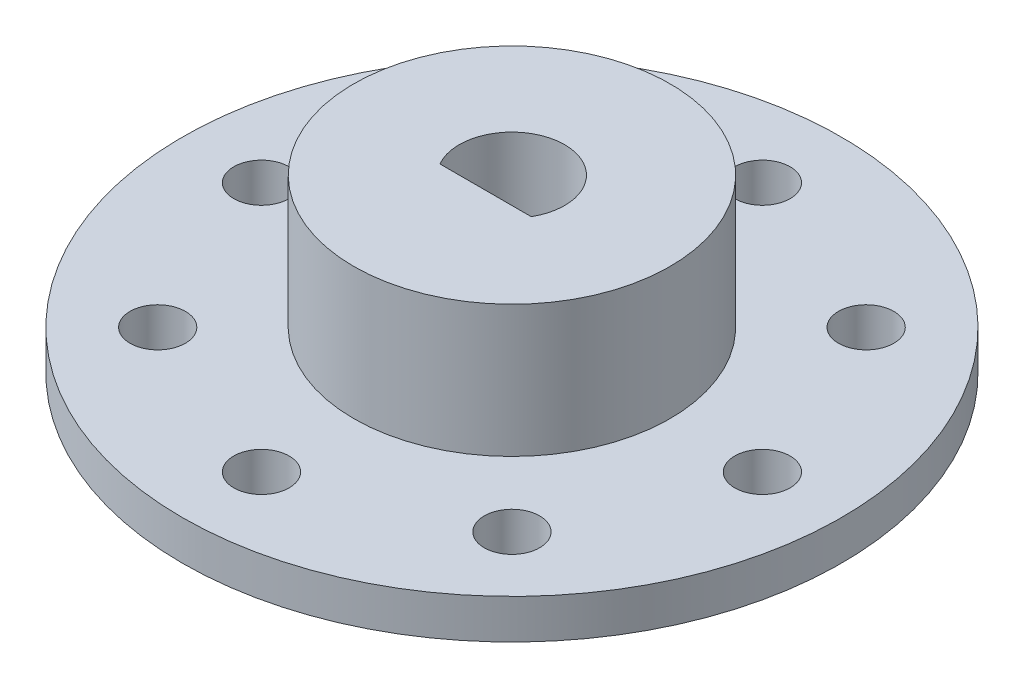
from build123d import *

# Parameters (mm, degrees)
SKETCH_1_R          = 25
SKETCH_1_R_2        = 2.1
EXTRUDE_1_DEPTH     = 3
SKETCH_2_R          = 12
EXTRUDE_2_DEPTH     = 10
CUT_EXTRUDE_START   = -20
CUT_EXTRUDE_1_DEPTH = 20


with BuildPart() as part:
    # 草图1 → 凸台-拉伸1 (new body)
    with BuildSketch(Plane(origin=(0, 0, 0), x_dir=(1, 0, 0), z_dir=(0, 1, 0))):
        with Locations(Location((0, 0, 0), (0, 0, 270))):
            Circle(SKETCH_1_R)
        with Locations(Location((0, 19, 0), (0, 0, 270))):
            Circle(SKETCH_1_R_2, mode=Mode.SUBTRACT)
        with Locations(Location((13.435028843, 13.435028843, 0), (0, 0, 270))):
            Circle(SKETCH_1_R_2, mode=Mode.SUBTRACT)
        with Locations(Location((19, 0, 0), (0, 0, 270))):
            Circle(SKETCH_1_R_2, mode=Mode.SUBTRACT)
        with Locations(Location((13.435028843, -13.435028843, 0), (0, 0, 270))):
            Circle(SKETCH_1_R_2, mode=Mode.SUBTRACT)
        with Locations(Location((0, -19, 0), (0, 0, 270))):
            Circle(SKETCH_1_R_2, mode=Mode.SUBTRACT)
        with Locations(Location((-13.435028843, -13.435028843, 0), (0, 0, 270))):
            Circle(SKETCH_1_R_2, mode=Mode.SUBTRACT)
        with Locations(Location((-19, 0, 0), (0, 0, 270))):
            Circle(SKETCH_1_R_2, mode=Mode.SUBTRACT)
        with Locations(Location((-13.435028843, 13.435028843, 0), (0, 0, 270))):
            Circle(SKETCH_1_R_2, mode=Mode.SUBTRACT)
    extrude(amount=EXTRUDE_1_DEPTH)

    # 草图2 → 凸台-拉伸2 (add)
    with BuildSketch(Plane(origin=(0, 3, 0), x_dir=(1, 0, 0), z_dir=(0, 1, 0))):
        with Locations(Location((0, 0, 0), (0, 0, 270))):
            Circle(SKETCH_2_R)
        with BuildLine():
            Line((-3.464101615, -2), (3.464101615, -2))
            ThreePointArc((3.464101615, -2), (0, 4), (-3.464101615, -2))
        make_face(mode=Mode.SUBTRACT)
    extrude(amount=EXTRUDE_2_DEPTH)

    # 草图3 → 切除-拉伸1 (cut)
    with BuildSketch(Plane(origin=(0, 13, 0), x_dir=(1, 0, 0), z_dir=(0, 1, 0)).offset(CUT_EXTRUDE_START)):
        with BuildLine():
            Line((-3.464101615, -2), (3.464101615, -2))
            ThreePointArc((3.464101615, -2), (0, 4), (-3.464101615, -2))
        make_face()
    extrude(amount=CUT_EXTRUDE_1_DEPTH, mode=Mode.SUBTRACT)


solid = part.part
